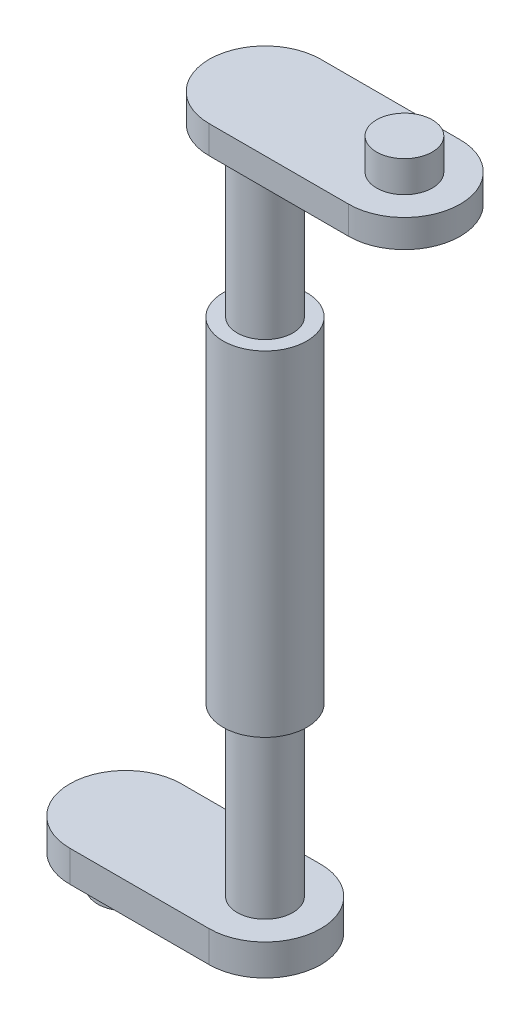
from build123d import *

# Parameters (mm, degrees)
SKETCH1_R           = 2.5
BOSS_EXTRUDE1_DEPTH = 30
SKETCH6_R           = 3.75
BOSS_EXTRUDE6_DEPTH = 15
BOSS_EXTRUDE2_DEPTH = 2.5
SKETCH3_R           = 2.5
BOSS_EXTRUDE3_DEPTH = 2.8
BOSS_EXTRUDE4_START = 2.8
BOSS_EXTRUDE4_DEPTH = 2.8
SKETCH5_R           = 2.5
BOSS_EXTRUDE5_DEPTH = 2.8


with BuildPart() as part:
    # Sketch1 → Boss-Extrude1 (new, symmetric)
    with BuildSketch(Plane(origin=(0, 0, 0), x_dir=(1, 0, 0), z_dir=(0, 1, 0))):
        with Locations(Location((0, 0, 0), (0, 0, 270))):
            Circle(SKETCH1_R)
    extrude(amount=BOSS_EXTRUDE1_DEPTH, both=True)

    # Sketch6 → Boss-Extrude6 (add, symmetric)
    with BuildSketch(Plane(origin=(0, 0, 0), x_dir=(1, 0, 0), z_dir=(0, 1, 0))):
        with Locations(Location((0, 0, 0), (0, 0, 270))):
            Circle(SKETCH6_R)
    extrude(amount=BOSS_EXTRUDE6_DEPTH, both=True)

    # Sketch2 → Boss-Extrude2 (add)
    with BuildSketch(Plane(origin=(0, 30, 0), x_dir=(1, 0, 0), z_dir=(0, 1, 0))):
        with BuildLine():
            Line((0, 5), (12.5, 5))
            ThreePointArc((12.5, 5), (17.5, 0), (12.5, -5))
            Line((12.5, -5), (0, -5))
            ThreePointArc((0, -5), (-5, 0), (0, 5))
        make_face()
    extrude(amount=BOSS_EXTRUDE2_DEPTH)

    # Sketch3 → Boss-Extrude3 (add)
    with BuildSketch(Plane(origin=(0, 32.5, 0), x_dir=(1, 0, 0), z_dir=(0, 1, 0))):
        with Locations(Location((12.5, 0, 0), (0, 0, 270))):
            Circle(SKETCH3_R)
    extrude(amount=BOSS_EXTRUDE3_DEPTH)

    # Sketch4 → Boss-Extrude4 (add)
    with BuildSketch(Plane.XZ.offset(30).offset(BOSS_EXTRUDE4_START)):
        with BuildLine():
            Line((0, -5), (-12.5, -5))
            ThreePointArc((-12.5, -5), (-17.5, 0), (-12.5, 5))
            Line((-12.5, 5), (0, 5))
            ThreePointArc((0, 5), (5, 0), (0, -5))
        make_face()
    extrude(amount=-BOSS_EXTRUDE4_DEPTH)

    # Sketch5 → Boss-Extrude5 (add)
    with BuildSketch(Plane.XZ.offset(32.8)):
        with Locations(Location((-12.5, 0, 0), (0, 0, 270))):
            Circle(SKETCH5_R)
    extrude(amount=BOSS_EXTRUDE5_DEPTH)


solid = part.part
